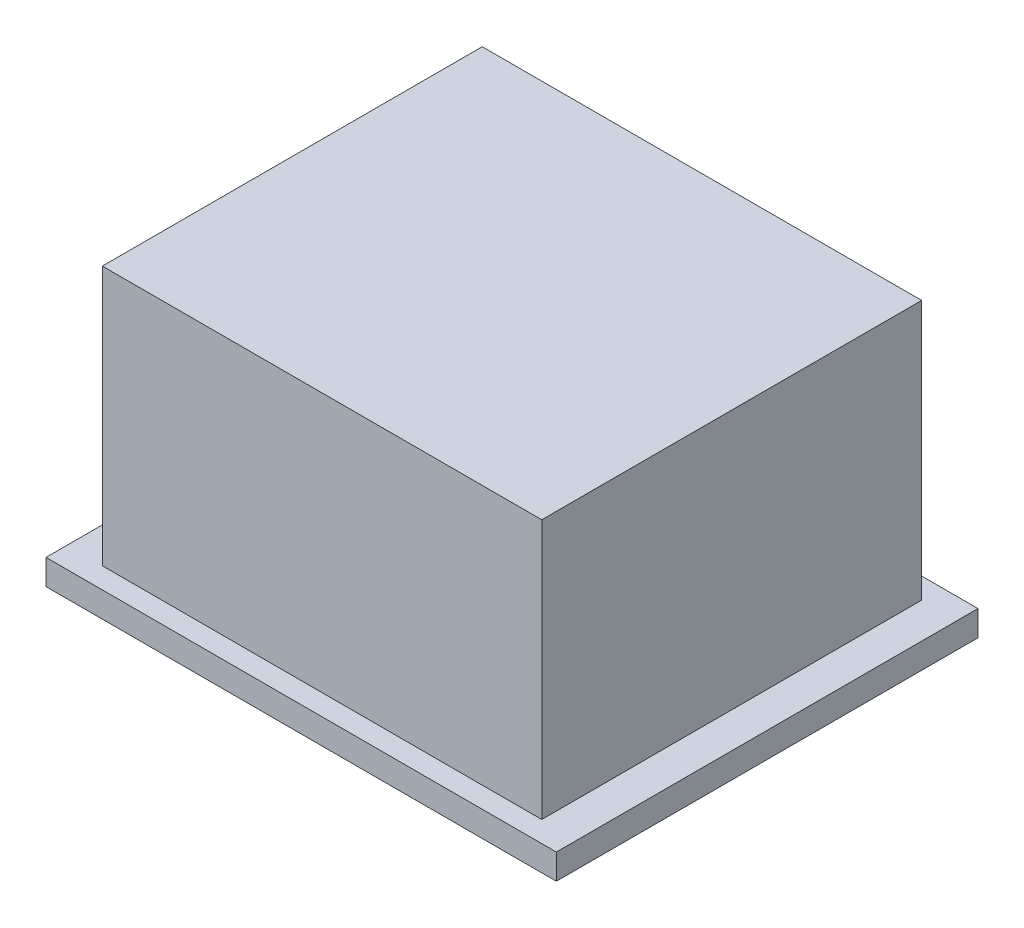
from build123d import *

# Parameters (mm, degrees)
SKETCH1_W           = 40.3
SKETCH1_H           = 33.3
BOSS_EXTRUDE1_DEPTH = 2
SKETCH2_W           = 34.7
SKETCH2_H           = 30
BOSS_EXTRUDE2_DEPTH = 20.5


with BuildPart() as part:
    # Sketch1 → Boss-Extrude1 (new body)
    with BuildSketch(Plane(origin=(0, 0, 0), x_dir=(1, 0, 0), z_dir=(0, 1, 0))):
        with Locations((20.15, 16.65)):
            Rectangle(SKETCH1_W, SKETCH1_H)
    extrude(amount=BOSS_EXTRUDE1_DEPTH)

    # Sketch2 → Boss-Extrude2 (add)
    with BuildSketch(Plane(origin=(0, 2, 0), x_dir=(1, 0, 0), z_dir=(0, 1, 0))):
        with Locations((20.15, 16.65)):
            Rectangle(SKETCH2_W, SKETCH2_H)
    extrude(amount=BOSS_EXTRUDE2_DEPTH)


solid = part.part
